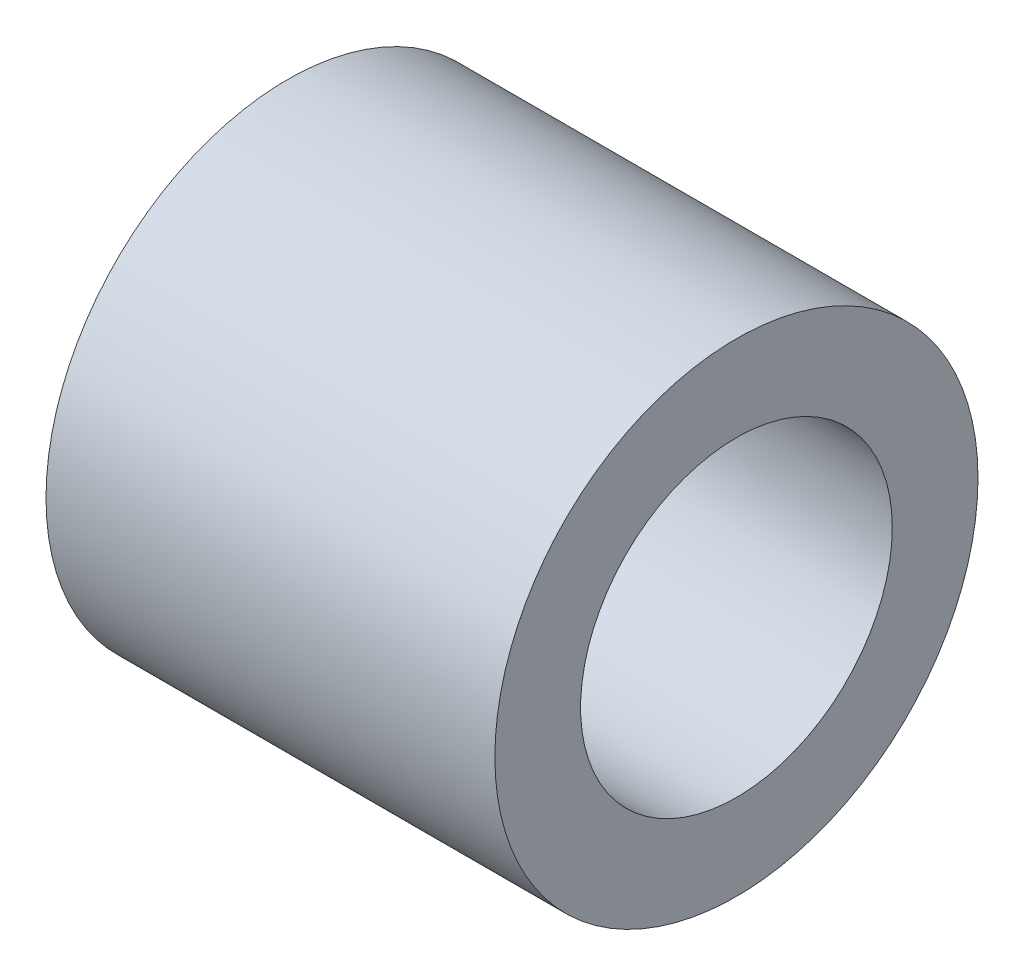
from build123d import *

# Parameters (mm, degrees)
SKETCH1_R           = 7.75
SKETCH1_R_2         = 5
BOSS_EXTRUDE1_DEPTH = 7.2


with BuildPart() as part:
    # Sketch1 → Boss-Extrude1 (new, symmetric)
    with BuildSketch(Plane(origin=(0, 0, 0), x_dir=(0, 0, -1), z_dir=(1, 0, 0))):
        Circle(SKETCH1_R)
        Circle(SKETCH1_R_2, mode=Mode.SUBTRACT)
    extrude(amount=BOSS_EXTRUDE1_DEPTH, both=True)


solid = part.part
